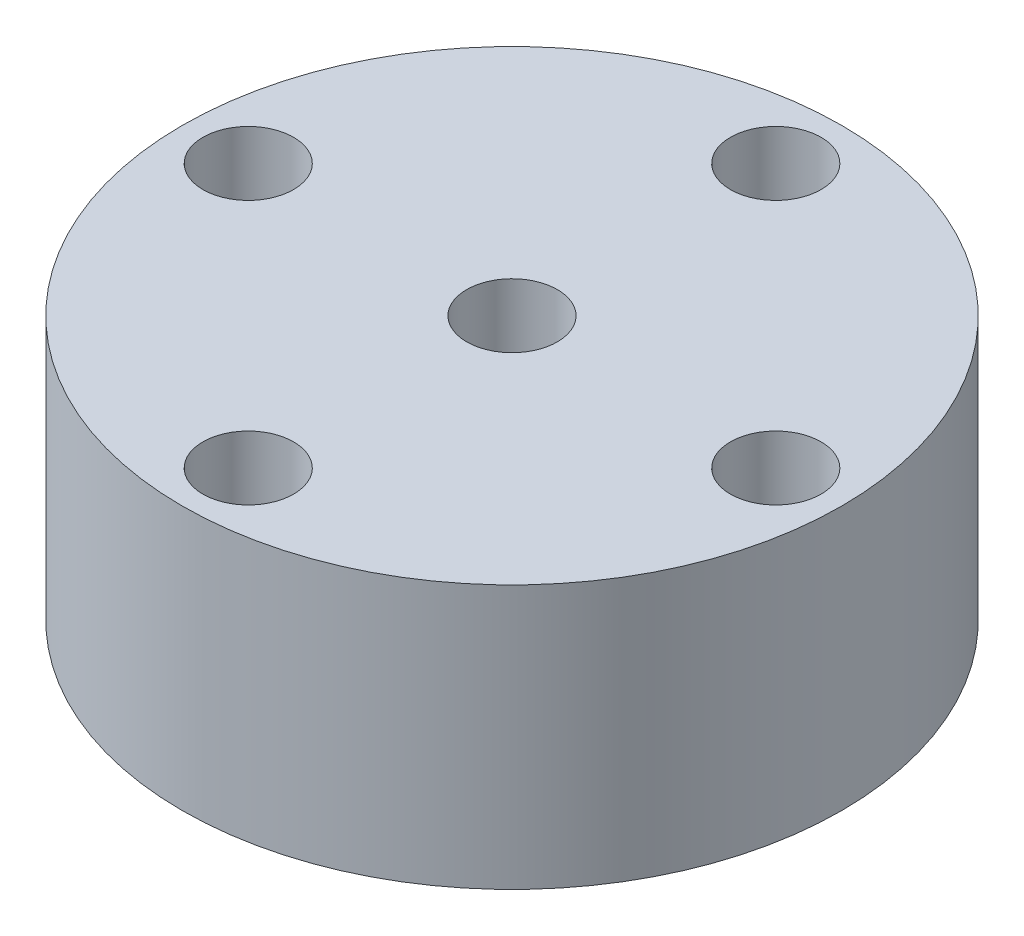
from build123d import *

# Parameters (mm, degrees)
SKETCH1_R           = 15.875
SKETCH1_R_2         = 2.1828125
BOSS_EXTRUDE1_DEPTH = 12.7


with BuildPart() as part:
    # Sketch1 → Boss-Extrude1 (new body)
    with BuildSketch(Plane(origin=(0, 0, 0), x_dir=(1, 0, 0), z_dir=(0, 1, 0))):
        with Locations(Location((0, 0, 0), (0, 0, 270))):
            Circle(SKETCH1_R)
        with Locations(Location((0, 0, 0), (0, 0, 270))):
            Circle(SKETCH1_R_2, mode=Mode.SUBTRACT)
        with Locations(Location((12.7, 0, 0), (0, 0, 270))):
            Circle(SKETCH1_R_2, mode=Mode.SUBTRACT)
        with Locations(Location((-12.7, 0, 0), (0, 0, 270))):
            Circle(SKETCH1_R_2, mode=Mode.SUBTRACT)
        with Locations(Location((0, 12.7, 0), (0, 0, 270))):
            Circle(SKETCH1_R_2, mode=Mode.SUBTRACT)
        with Locations(Location((0, -12.7, 0), (0, 0, 270))):
            Circle(SKETCH1_R_2, mode=Mode.SUBTRACT)
    extrude(amount=BOSS_EXTRUDE1_DEPTH)


solid = part.part
